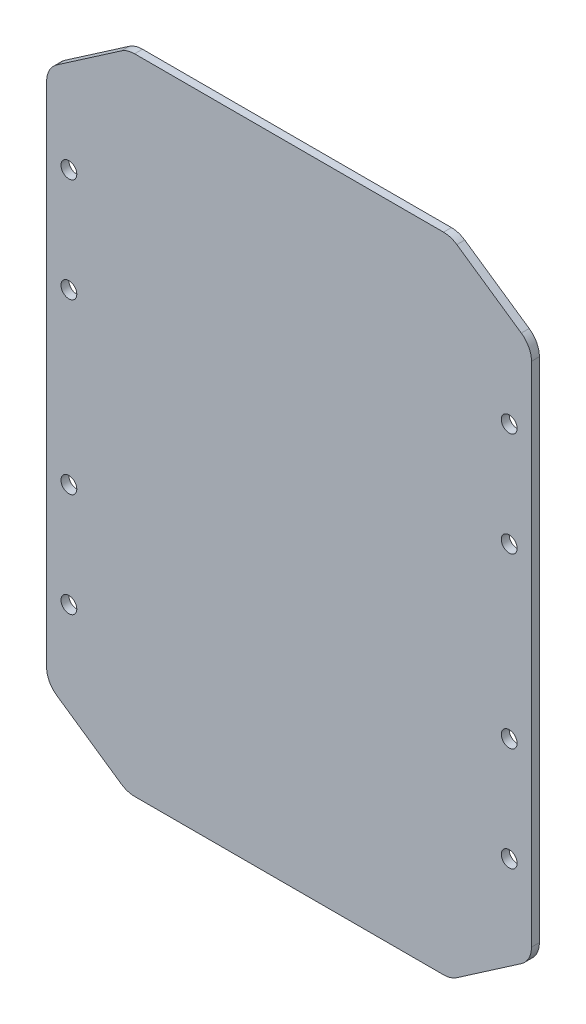
from build123d import *

# Parameters (mm, degrees)
SKETCH_1_R      = 1.6
EXTRUDE_1_DEPTH = 1.6


with BuildPart() as part:
    # Эскиз1 → Бобышка-Вытянуть1 (new body)
    with BuildSketch(Plane.XY):
        with BuildLine():
            Line((33.914602025, -64.162611141), (46.943320266, -55.194045236))
            ThreePointArc((46.943320266, -55.194045236), (48.454507775, -53.491550465), (49, -51.281434095))
            Line((49, -51.281434095), (49, 51.281434095))
            ThreePointArc((49, 51.281434095), (48.454507775, 53.491550465), (46.943320266, 55.194045236))
            Line((46.943320266, 55.194045236), (33.914602025, 64.162611141))
            ThreePointArc((33.914602025, 64.162611141), (32.631529446, 64.785824232), (31.221281759, 65))
            Line((31.221281759, 65), (-31.221281759, 65))
            ThreePointArc((-31.221281759, 65), (-32.631529446, 64.785824232), (-33.914602025, 64.162611141))
            Line((-33.914602025, 64.162611141), (-46.943320266, 55.194045236))
            ThreePointArc((-46.943320266, 55.194045236), (-48.454507775, 53.491550465), (-49, 51.281434095))
            Line((-49, 51.281434095), (-49, -51.281434095))
            ThreePointArc((-49, -51.281434095), (-48.454507775, -53.491550465), (-46.943320266, -55.194045236))
            Line((-46.943320266, -55.194045236), (-33.914602025, -64.162611141))
            ThreePointArc((-33.914602025, -64.162611141), (-32.631529446, -64.785824232), (-31.221281759, -65))
            Line((-31.221281759, -65), (31.221281759, -65))
            ThreePointArc((31.221281759, -65), (32.631529446, -64.785824232), (33.914602025, -64.162611141))
        make_face()
        with Locations((44.5, 17.056509603)):
            Circle(SKETCH_1_R, mode=Mode.SUBTRACT)
        with Locations((-44.5, -17.056509603)):
            Circle(SKETCH_1_R, mode=Mode.SUBTRACT)
        with Locations((-44.5, 17.056509603)):
            Circle(SKETCH_1_R, mode=Mode.SUBTRACT)
        with Locations((-44.5, 38.056509603)):
            Circle(SKETCH_1_R, mode=Mode.SUBTRACT)
        with Locations((-44.5, -38.056509603)):
            Circle(SKETCH_1_R, mode=Mode.SUBTRACT)
        with Locations((44.5, -17.056509603)):
            Circle(SKETCH_1_R, mode=Mode.SUBTRACT)
        with Locations((44.5, -38.056509603)):
            Circle(SKETCH_1_R, mode=Mode.SUBTRACT)
        with Locations((44.5, 38.056509603)):
            Circle(SKETCH_1_R, mode=Mode.SUBTRACT)
    extrude(amount=EXTRUDE_1_DEPTH)


solid = part.part
